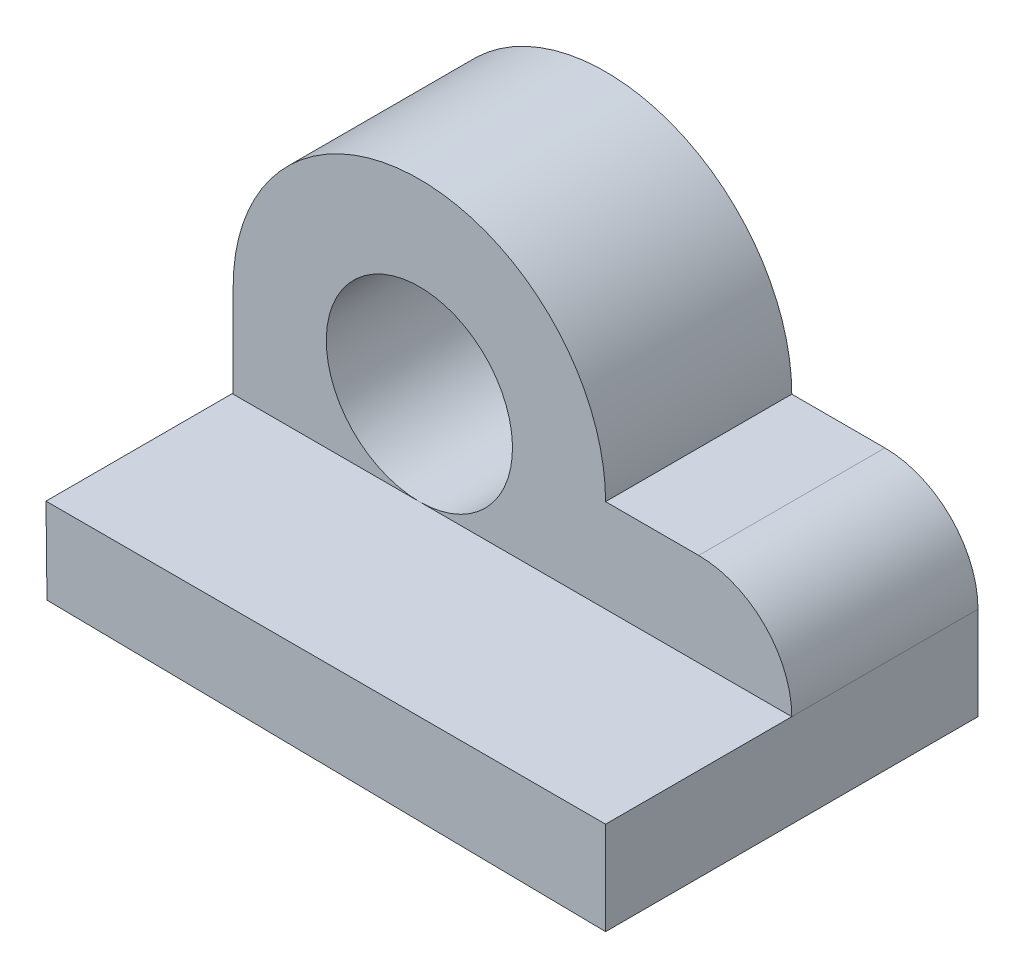
from build123d import *

# Parameters (mm, degrees)
SKETCH1_R           = 10
BOSS_EXTRUDE1_DEPTH = 20
BOSS_EXTRUDE2_DEPTH = 20


with BuildPart() as part:
    # Sketch1 → Boss-Extrude1 (new body)
    with BuildSketch(Plane.XY):
        with BuildLine():
            Line((-20, 0), (-20, -10))
            Line((-20, -10), (-20, -19.161425494))
            Line((-20, -19.161425494), (40, -20))
            Line((40, -20), (40, -10))
            ThreePointArc((40, -10), (37.071067812, -2.928932188), (30, 0))
            Line((30, 0), (20, 0))
            ThreePointArc((20, 0), (0, 20), (-20, 0))
        make_face()
        Circle(SKETCH1_R, mode=Mode.SUBTRACT)
    extrude(amount=BOSS_EXTRUDE1_DEPTH)

    # Sketch3 → Boss-Extrude2 (add)
    with BuildSketch(Plane.XY.offset(20)):
        Polygon((-20.104236771, -10), (40, -10), (40, -20), (-20, -19.161425494), align=None)
    extrude(amount=BOSS_EXTRUDE2_DEPTH)


solid = part.part
